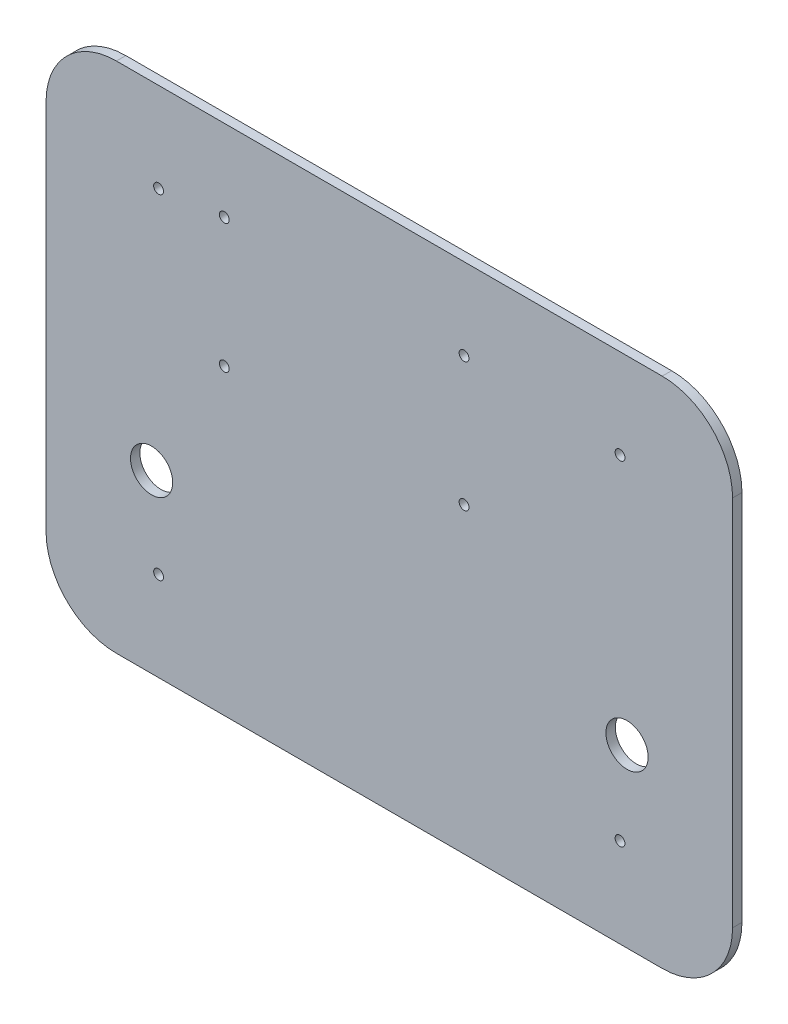
from build123d import *

# Parameters (mm, degrees)
SKETCH1_R           = 9
SKETCH1_R_2         = 2.1
BOSS_EXTRUDE1_DEPTH = 4
SKETCH2_R           = 2.1
CUT_EXTRUDE1_DEPTH  = 183.748067126


with BuildPart() as part:
    # Sketch1 → Boss-Extrude1 (new body)
    with BuildSketch(Plane.XY):
        with BuildLine():
            Line((-116.359993818, -109.359993818), (116.359993818, -109.359993818))
            ThreePointArc((116.359993818, -109.359993818), (137.573197254, -100.573197254), (146.359993818, -79.359993818))
            Line((146.359993818, -79.359993818), (146.359993818, 79.359993818))
            ThreePointArc((146.359993818, 79.359993818), (137.573197254, 100.573197254), (116.359993818, 109.359993818))
            Line((116.359993818, 109.359993818), (-116.359993818, 109.359993818))
            ThreePointArc((-116.359993818, 109.359993818), (-137.573197254, 100.573197254), (-146.359993818, 79.359993818))
            Line((-146.359993818, 79.359993818), (-146.359993818, -79.359993818))
            ThreePointArc((-146.359993818, -79.359993818), (-137.573197254, -100.573197254), (-116.359993818, -109.359993818))
        make_face()
        with Locations((-101.359993818, -34.359993818)):
            Circle(SKETCH1_R, mode=Mode.SUBTRACT)
        with Locations((101.359993818, -34.359993818)):
            Circle(SKETCH1_R, mode=Mode.SUBTRACT)
        with Locations((-98.375, 71.25)):
            Circle(SKETCH1_R_2, mode=Mode.SUBTRACT)
        with Locations((98.375, 71.25)):
            Circle(SKETCH1_R_2, mode=Mode.SUBTRACT)
        with Locations((98.375, -71.25)):
            Circle(SKETCH1_R_2, mode=Mode.SUBTRACT)
        with Locations((-98.375, -71.25)):
            Circle(SKETCH1_R_2, mode=Mode.SUBTRACT)
    extrude(amount=BOSS_EXTRUDE1_DEPTH)

    # Sketch2 → Cut-Extrude1 (cut, through all)
    with BuildSketch(Plane.XY.offset(4)):
        with Locations((-70.359993818, 74.659993818)):
            Circle(SKETCH2_R)
        with Locations((-70.359993818, 19.659993818)):
            Circle(SKETCH2_R)
        with Locations((31.859993818, 74.659993818)):
            Circle(SKETCH2_R)
        with Locations((31.859993818, 19.659993818)):
            Circle(SKETCH2_R)
    extrude(amount=-CUT_EXTRUDE1_DEPTH, mode=Mode.SUBTRACT)


solid = part.part
